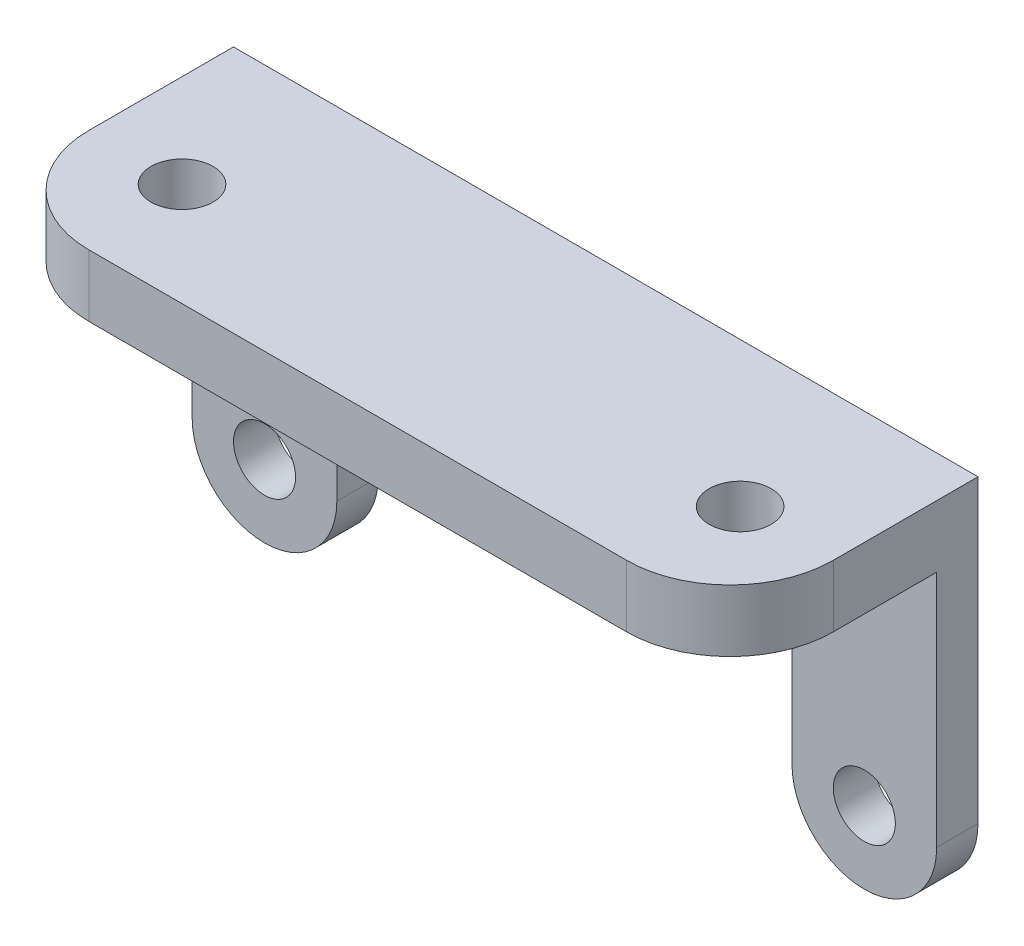
from build123d import *

# Parameters (mm, degrees)
SKETCH_1_R          = 1.5
EXTRUDE_1_DEPTH     = 2
SKETCH_2_W          = 36.017
SKETCH_2_H          = 3
EXTRUDE_2_DEPTH     = 10
SKETCH_3_R          = 1.5
CUT_EXTRUDE_1_DEPTH = 29.168487204
FILLET_1_R          = 5


with BuildPart() as part:
    # 草图1 → 凸台-拉伸1 (new body)
    with BuildSketch(Plane.XY):
        with BuildLine():
            Line((-18.0085, 2.5), (18.0085, 2.5))
            Line((18.0085, 2.5), (18.0085, -2.5))
            Line((18.0085, -2.5), (18.0085, -12.032126861))
            ThreePointArc((18.0085, -12.032126861), (14.5085, -15.532126861), (11.0085, -12.032126861))
            Line((11.0085, -12.032126861), (11.0085, -3.595826486))
            Line((11.0085, -3.595826486), (-11.0085, -3.595826486))
            Line((-11.0085, -3.595826486), (-11.0085, -12.032126861))
            ThreePointArc((-11.0085, -12.032126861), (-14.5085, -15.532126861), (-18.0085, -12.032126861))
            Line((-18.0085, -12.032126861), (-18.0085, -2.5))
            Line((-18.0085, -2.5), (-18.0085, 2.5))
        make_face()
        with Locations((-14.5085, -12.032126861)):
            Circle(SKETCH_1_R, mode=Mode.SUBTRACT)
        with Locations(Location((14.5085, -12.032126861, 0), (0, 0, 180))):
            Circle(SKETCH_1_R, mode=Mode.SUBTRACT)
    extrude(amount=EXTRUDE_1_DEPTH)

    # 草图2 → 凸台-拉伸2 (add)
    with BuildSketch(Plane.XY.offset(2)):
        with Locations((0, 1)):
            Rectangle(SKETCH_2_W, SKETCH_2_H)
    extrude(amount=EXTRUDE_2_DEPTH)

    # 草图3 → 切除-拉伸1 (cut, through all)
    with BuildSketch(Plane(origin=(0, 2.5, 0), x_dir=(1, 0, 0), z_dir=(0, 1, 0))):
        with Locations(Location((-13.5, -7, 0), (0, 0, 180))):
            Circle(SKETCH_3_R)
        with Locations(Location((13.5, -7, 0), (0, 0, 180))):
            Circle(SKETCH_3_R)
    extrude(amount=-CUT_EXTRUDE_1_DEPTH, mode=Mode.SUBTRACT)

    # 圆角1
    fillet_1_edges = [part.edges().sort_by_distance(p)[0] for p in [
        (-18.0085, 1, 12),
        (18.0085, 1, 12),
    ]]
    fillet(fillet_1_edges, radius=FILLET_1_R)


solid = part.part
